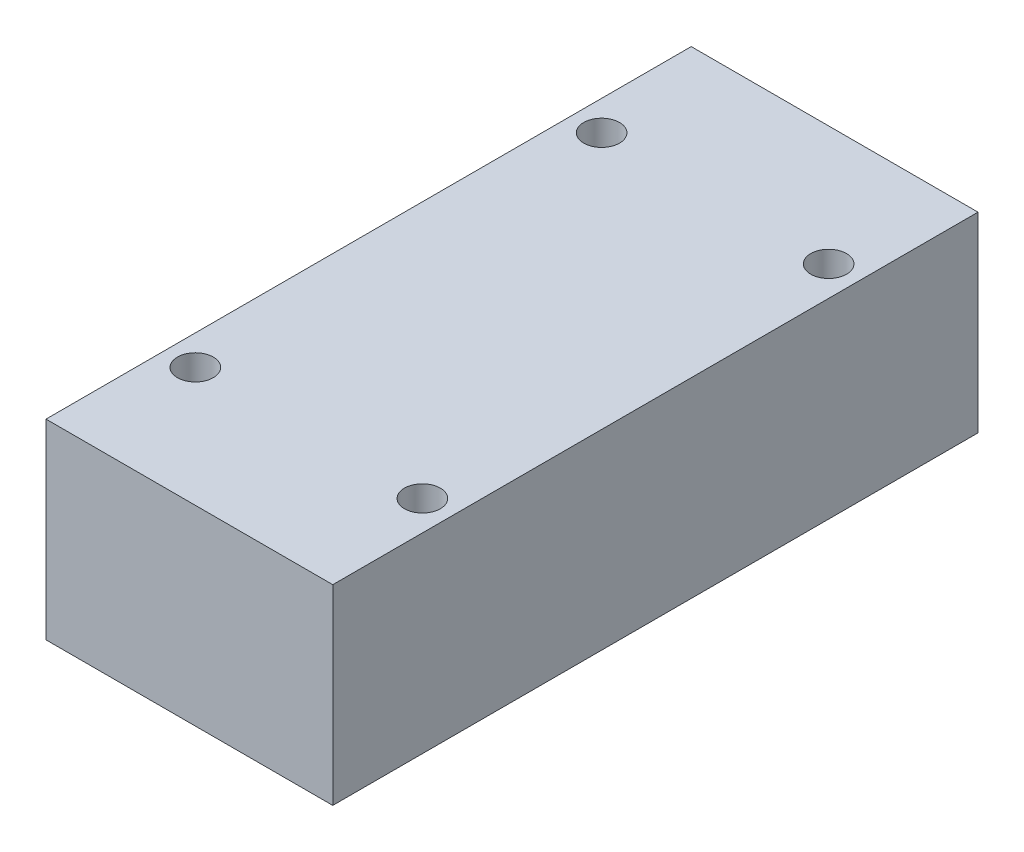
from build123d import *

# Parameters (mm, degrees)
SKETCH_1_W         = 24
SKETCH_1_H         = 16
EXTRUDE_1_DEPTH    = 27
SKETCH1_R          = 1.5
CUT_EXTRUDE1_DEPTH = 34.600595233


with BuildPart() as part:
    # 草图1 → 凸台-拉伸1 (new, symmetric)
    with BuildSketch(Plane.XY):
        Rectangle(SKETCH_1_W, SKETCH_1_H)
    extrude(amount=EXTRUDE_1_DEPTH, both=True)

    # Sketch1 → Cut-Extrude1 (cut, through all)
    with BuildSketch(Plane(origin=(0, 8, 0), x_dir=(1, 0, 0), z_dir=(0, 1, 0))):
        with Locations(Location((-9.5, 17, 0), (0, 0, 180))):
            Circle(SKETCH1_R)
        with Locations((9.5, 17)):
            Circle(SKETCH1_R)
        with Locations(Location((9.5, -17, 0), (0, 0, 180))):
            Circle(SKETCH1_R)
        with Locations((-9.5, -17)):
            Circle(SKETCH1_R)
    extrude(amount=-CUT_EXTRUDE1_DEPTH, mode=Mode.SUBTRACT)


solid = part.part
